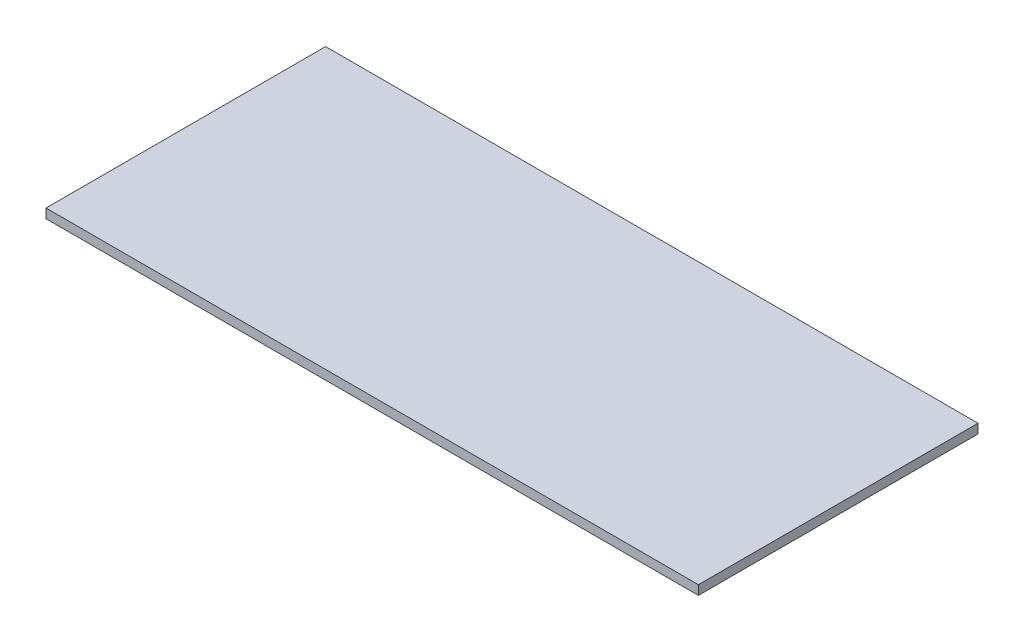
from build123d import *

# Parameters (mm, degrees)
CROQUIS2_W              = 700
CROQUIS2_H              = 300
SALIENTE_EXTRUIR1_DEPTH = 10


with BuildPart() as part:
    # Croquis2 → Saliente-Extruir1 (new body)
    with BuildSketch(Plane(origin=(0, 0, 0), x_dir=(1, 0, 0), z_dir=(0, 1, 0))):
        Rectangle(CROQUIS2_W, CROQUIS2_H)
    extrude(amount=SALIENTE_EXTRUIR1_DEPTH)


solid = part.part
